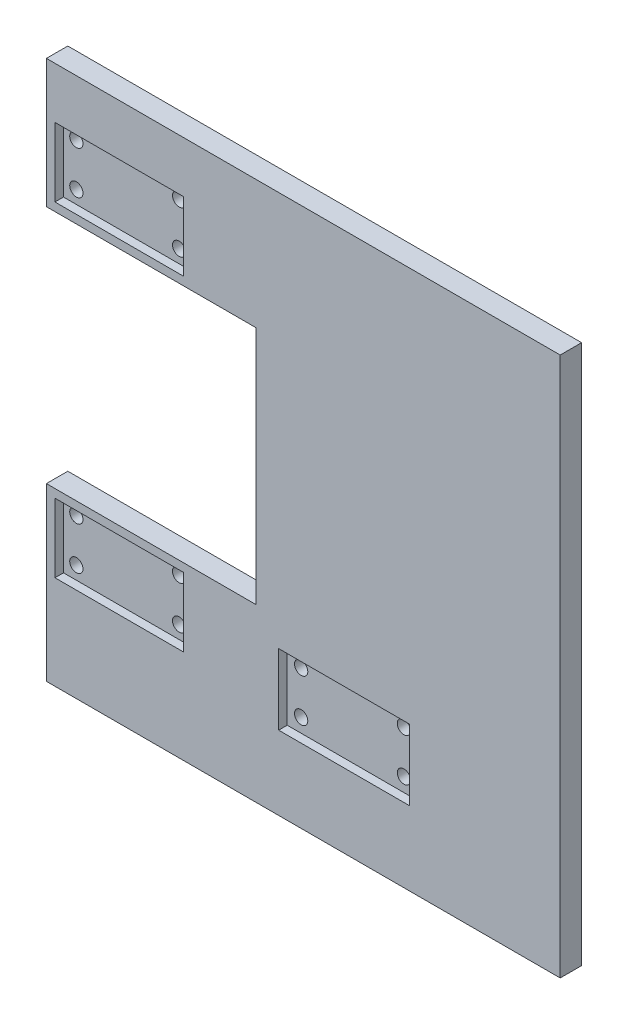
from build123d import *

# Parameters (mm, degrees)
EXTRUDE_2_DEPTH     = 5
SKETCH_3_W          = 30
SKETCH_3_H          = 16.1
CUT_EXTRUDE_1_DEPTH = 2
CUT_EXTRUDE_2_REACH = 155.704
SKETCH_4_R          = 1.55
CUT_EXTRUDE_3_REACH = 155.756
SKETCH_5_W          = 32
SKETCH_5_H          = 56
SKETCH_7_W          = 40.5
SKETCH_7_H          = 40.5
EXTRUDE_4_DEPTH     = 2
SKETCH_8_W          = 30.5
SKETCH_8_H          = 16.5
CUT_EXTRUDE_4_DEPTH = 2
SKETCH_9_R          = 1.55
CUT_EXTRUDE_6_DEPTH = 154.727030805
SKETCH_10_W         = 60
SKETCH_10_H         = 45
EXTRUDE_5_DEPTH     = 2
SKETCH_11_W         = 60
SKETCH_11_H         = 45
CUT_EXTRUDE_8_DEPTH = 2


with BuildPart() as part:
    # 草图1 → 凸台-拉伸2 (new body)
    with BuildSketch(Plane.XY):
        Polygon((0, 0), (0, 30), (120, 30), (120, -96), (0, -96), (0, -56), (45, -56), (45, 0), align=None)
    extrude(amount=EXTRUDE_2_DEPTH)

    # 草图3 → 切除-拉伸1 (cut)
    with BuildSketch(Plane.XY.offset(5)):
        with Locations((17, 10)):
            Rectangle(SKETCH_3_W, SKETCH_3_H)
        with Locations((17, -66)):
            Rectangle(SKETCH_3_W, SKETCH_3_H)
    extrude(amount=-CUT_EXTRUDE_1_DEPTH, mode=Mode.SUBTRACT)

    # 草图4 → 切除-拉伸2 (cut, up to next)
    with BuildSketch(Plane.XY.offset(3), mode=Mode.PRIVATE) as cut_extrude_2_sk1:
        with Locations((29, 15)):
            Circle(SKETCH_4_R)
    cut_extrude_2_tool1 = extrude(cut_extrude_2_sk1.sketch, amount=-CUT_EXTRUDE_2_REACH, mode=Mode.PRIVATE) & part.part
    # 草图4 → 切除-拉伸2 (cut, up to next)
    with BuildSketch(Plane.XY.offset(3), mode=Mode.PRIVATE) as cut_extrude_2_sk2:
        with Locations((29, 5)):
            Circle(SKETCH_4_R)
    cut_extrude_2_tool2 = extrude(cut_extrude_2_sk2.sketch, amount=-CUT_EXTRUDE_2_REACH, mode=Mode.PRIVATE) & part.part
    # 草图4 → 切除-拉伸2 (cut, up to next)
    with BuildSketch(Plane.XY.offset(3), mode=Mode.PRIVATE) as cut_extrude_2_sk3:
        with BuildLine():
            ThreePointArc((5, 16.55), (3.903984489, 16.096015511), (3.45, 15))
            Line((3.45, 15), (5, 15))
            Line((5, 15), (5, 16.55))
        make_face()
    cut_extrude_2_tool3 = extrude(cut_extrude_2_sk3.sketch, amount=-CUT_EXTRUDE_2_REACH, mode=Mode.PRIVATE) & part.part
    # 草图4 → 切除-拉伸2 (cut, up to next)
    with BuildSketch(Plane.XY.offset(3), mode=Mode.PRIVATE) as cut_extrude_2_sk4:
        with BuildLine():
            Line((5, 15), (3.45, 15))
            ThreePointArc((3.45, 15), (5, 13.45), (6.55, 15))
            ThreePointArc((6.55, 15), (6.096015511, 16.096015511), (5, 16.55))
            Line((5, 16.55), (5, 15))
        make_face()
    cut_extrude_2_tool4 = extrude(cut_extrude_2_sk4.sketch, amount=-CUT_EXTRUDE_2_REACH, mode=Mode.PRIVATE) & part.part
    # 草图4 → 切除-拉伸2 (cut, up to next)
    with BuildSketch(Plane.XY.offset(3), mode=Mode.PRIVATE) as cut_extrude_2_sk5:
        with BuildLine():
            ThreePointArc((5, 16.55), (3.903984489, 16.096015511), (3.45, 15))
            Line((3.45, 15), (5, 15))
            Line((5, 15), (5, 16.55))
        make_face()
    cut_extrude_2_tool5 = extrude(cut_extrude_2_sk5.sketch, amount=-CUT_EXTRUDE_2_REACH, mode=Mode.PRIVATE) & part.part
    # 草图4 → 切除-拉伸2 (cut, up to next)
    with BuildSketch(Plane.XY.offset(3), mode=Mode.PRIVATE) as cut_extrude_2_sk6:
        with BuildLine():
            Line((5, 15), (3.45, 15))
            ThreePointArc((3.45, 15), (5, 13.45), (6.55, 15))
            ThreePointArc((6.55, 15), (6.096015511, 16.096015511), (5, 16.55))
            Line((5, 16.55), (5, 15))
        make_face()
    cut_extrude_2_tool6 = extrude(cut_extrude_2_sk6.sketch, amount=-CUT_EXTRUDE_2_REACH, mode=Mode.PRIVATE) & part.part
    # 草图4 → 切除-拉伸2 (cut, up to next)
    with BuildSketch(Plane.XY.offset(3), mode=Mode.PRIVATE) as cut_extrude_2_sk7:
        with Locations((5, 5)):
            Circle(SKETCH_4_R)
    cut_extrude_2_tool7 = extrude(cut_extrude_2_sk7.sketch, amount=-CUT_EXTRUDE_2_REACH, mode=Mode.PRIVATE) & part.part
    # 草图4 → 切除-拉伸2 (cut, up to next)
    with BuildSketch(Plane.XY.offset(3), mode=Mode.PRIVATE) as cut_extrude_2_sk8:
        with Locations((5, -61)):
            Circle(SKETCH_4_R)
    cut_extrude_2_tool8 = extrude(cut_extrude_2_sk8.sketch, amount=-CUT_EXTRUDE_2_REACH, mode=Mode.PRIVATE) & part.part
    # 草图4 → 切除-拉伸2 (cut, up to next)
    with BuildSketch(Plane.XY.offset(3), mode=Mode.PRIVATE) as cut_extrude_2_sk9:
        with Locations((5, -71)):
            Circle(SKETCH_4_R)
    cut_extrude_2_tool9 = extrude(cut_extrude_2_sk9.sketch, amount=-CUT_EXTRUDE_2_REACH, mode=Mode.PRIVATE) & part.part
    # 草图4 → 切除-拉伸2 (cut, up to next)
    with BuildSketch(Plane.XY.offset(3), mode=Mode.PRIVATE) as cut_extrude_2_sk10:
        with Locations((29, -61)):
            Circle(SKETCH_4_R)
    cut_extrude_2_tool10 = extrude(cut_extrude_2_sk10.sketch, amount=-CUT_EXTRUDE_2_REACH, mode=Mode.PRIVATE) & part.part
    # 草图4 → 切除-拉伸2 (cut, up to next)
    with BuildSketch(Plane.XY.offset(3), mode=Mode.PRIVATE) as cut_extrude_2_sk11:
        with Locations((29, -71)):
            Circle(SKETCH_4_R)
    cut_extrude_2_tool11 = extrude(cut_extrude_2_sk11.sketch, amount=-CUT_EXTRUDE_2_REACH, mode=Mode.PRIVATE) & part.part
    add(cut_extrude_2_tool1.solids().sort_by_distance((29, 15, 3))[0], mode=Mode.SUBTRACT)
    add(cut_extrude_2_tool2.solids().sort_by_distance((29, 5, 3))[0], mode=Mode.SUBTRACT)
    add(cut_extrude_2_tool3.solids().sort_by_distance((4.34216, 15.65784, 3))[0], mode=Mode.SUBTRACT)
    add(cut_extrude_2_tool4.solids().sort_by_distance((5.21928, 14.78072, 3))[0], mode=Mode.SUBTRACT)
    add(cut_extrude_2_tool5.solids().sort_by_distance((4.34216, 15.65784, 3))[0], mode=Mode.SUBTRACT)
    add(cut_extrude_2_tool6.solids().sort_by_distance((5.21928, 14.78072, 3))[0], mode=Mode.SUBTRACT)
    add(cut_extrude_2_tool7.solids().sort_by_distance((5, 5, 3))[0], mode=Mode.SUBTRACT)
    add(cut_extrude_2_tool8.solids().sort_by_distance((5, -61, 3))[0], mode=Mode.SUBTRACT)
    add(cut_extrude_2_tool9.solids().sort_by_distance((5, -71, 3))[0], mode=Mode.SUBTRACT)
    add(cut_extrude_2_tool10.solids().sort_by_distance((29, -61, 3))[0], mode=Mode.SUBTRACT)
    add(cut_extrude_2_tool11.solids().sort_by_distance((29, -71, 3))[0], mode=Mode.SUBTRACT)

    # 草图5 → 切除-拉伸3 (cut, up to next)
    with BuildSketch(Plane.XY.offset(5), mode=Mode.PRIVATE) as cut_extrude_3_sk1:
        with Locations((33, -28)):
            Rectangle(SKETCH_5_W, SKETCH_5_H)
    cut_extrude_3_tool1 = extrude(cut_extrude_3_sk1.sketch, amount=-CUT_EXTRUDE_3_REACH, mode=Mode.PRIVATE) & part.part
    add(cut_extrude_3_tool1.solids().sort_by_distance((33, -28, 5))[0], mode=Mode.SUBTRACT)

    # 草图7 → 凸台-拉伸4 (add)
    with BuildSketch(Plane.XY.offset(5)):
        with Locations((79.25, -35.75)):
            Rectangle(SKETCH_7_W, SKETCH_7_H)
    extrude(amount=EXTRUDE_4_DEPTH)

    # 草图8 → 切除-拉伸4 (cut)
    with BuildSketch(Plane.XY.offset(5)):
        with Locations((69.5, -70.5)):
            Rectangle(SKETCH_8_W, SKETCH_8_H)
    extrude(amount=-CUT_EXTRUDE_4_DEPTH, mode=Mode.SUBTRACT)

    # 草图9 → 切除-拉伸6 (cut, through all)
    with BuildSketch(Plane.XY.offset(3)):
        with Locations((81.5, -65.5)):
            Circle(SKETCH_9_R)
        with Locations((57.5, -65.5)):
            Circle(SKETCH_9_R)
        with Locations(Location((57.5, -75.5, 0), (0, 0, 180))):
            Circle(SKETCH_9_R)
        with Locations((81.5, -75.5)):
            Circle(SKETCH_9_R)
    extrude(amount=-CUT_EXTRUDE_6_DEPTH, mode=Mode.SUBTRACT)

    # 草图10 → 凸台-拉伸5 (add)
    with BuildSketch(Plane.XY.offset(7)):
        with Locations((89, -33.5)):
            Rectangle(SKETCH_10_W, SKETCH_10_H)
    extrude(amount=-EXTRUDE_5_DEPTH)

    # 草图11 → 切除-拉伸8 (cut)
    with BuildSketch(Plane.XY.offset(5)):
        with Locations((89, -33.5)):
            Rectangle(SKETCH_11_W, SKETCH_11_H)
    extrude(amount=CUT_EXTRUDE_8_DEPTH, mode=Mode.SUBTRACT)


solid = part.part
